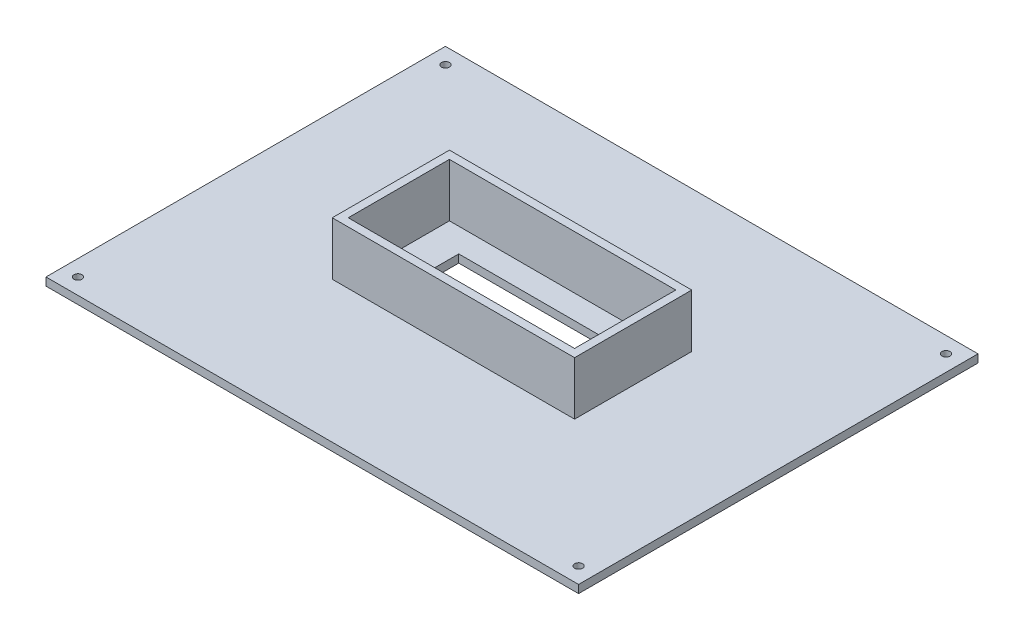
from build123d import *

# Parameters (mm, degrees)
SKETCH1_W           = 200
SKETCH1_H           = 150
BOSS_EXTRUDE1_DEPTH = 3
SKETCH2_R           = 1.5
CUT_EXTRUDE1_DEPTH  = 126.035994817
SKETCH3_W           = 60
SKETCH3_H           = 20
CUT_EXTRUDE2_DEPTH  = 126.035994817
SKETCH4_W           = 91
SKETCH4_H           = 44
SKETCH4_W_2         = 85
SKETCH4_H_2         = 38
BOSS_EXTRUDE2_DEPTH = 20


with BuildPart() as part:
    # Sketch1 → Boss-Extrude1 (new body)
    with BuildSketch(Plane(origin=(0, 0, 0), x_dir=(1, 0, 0), z_dir=(0, 1, 0))):
        Rectangle(SKETCH1_W, SKETCH1_H)
    extrude(amount=BOSS_EXTRUDE1_DEPTH)

    # Sketch2 → Cut-Extrude1 (cut, through all)
    with BuildSketch(Plane(origin=(0, 3, 0), x_dir=(1, 0, 0), z_dir=(0, 1, 0))):
        with Locations(Location((94, -69, 0), (0, 0, 270))):
            Circle(SKETCH2_R)
        with Locations(Location((94, 69, 0), (0, 0, 90))):
            Circle(SKETCH2_R)
        with Locations(Location((-94, -69, 0), (0, 0, 90))):
            Circle(SKETCH2_R)
        with Locations(Location((-94, 69, 0), (0, 0, 270))):
            Circle(SKETCH2_R)
    extrude(amount=-CUT_EXTRUDE1_DEPTH, mode=Mode.SUBTRACT)

    # Sketch3 → Cut-Extrude2 (cut, through all)
    with BuildSketch(Plane(origin=(0, 3, 0), x_dir=(1, 0, 0), z_dir=(0, 1, 0))):
        Rectangle(SKETCH3_W, SKETCH3_H)
    extrude(amount=-CUT_EXTRUDE2_DEPTH, mode=Mode.SUBTRACT)

    # Sketch4 → Boss-Extrude2 (add)
    with BuildSketch(Plane(origin=(0, 3, 0), x_dir=(1, 0, 0), z_dir=(0, 1, 0))):
        Rectangle(SKETCH4_W, SKETCH4_H)
        Rectangle(SKETCH4_W_2, SKETCH4_H_2, mode=Mode.SUBTRACT)
    extrude(amount=BOSS_EXTRUDE2_DEPTH)


solid = part.part
